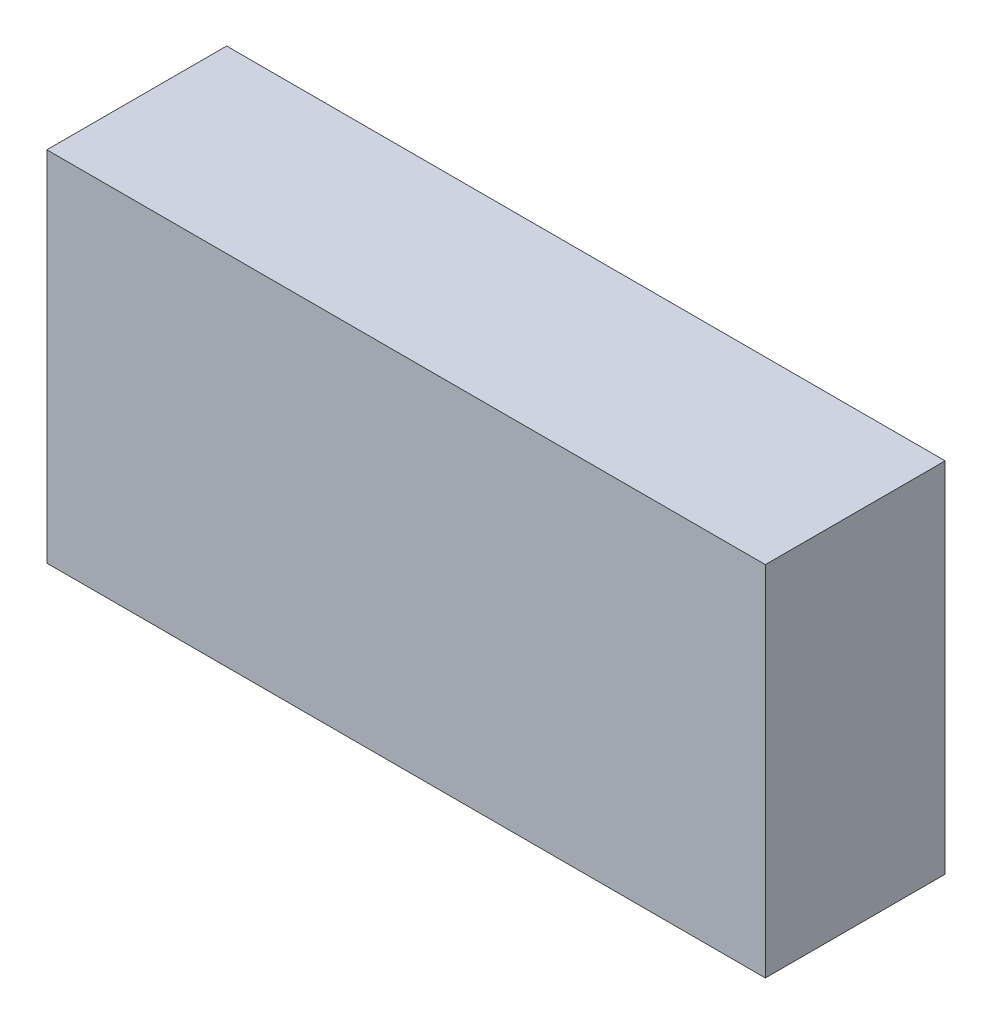
from build123d import *

# Parameters (mm, degrees)
SKIZZE1_W               = 3.9968
SKIZZE1_H               = 1.9914
COMPONENT_OUTLINE_DEPTH = 1


with BuildPart() as part:
    # Skizze1 → Component_Outline (new body)
    with BuildSketch(Plane.XY):
        with Locations((0, 0.0127)):
            Rectangle(SKIZZE1_W, SKIZZE1_H)
    extrude(amount=COMPONENT_OUTLINE_DEPTH)


solid = part.part
